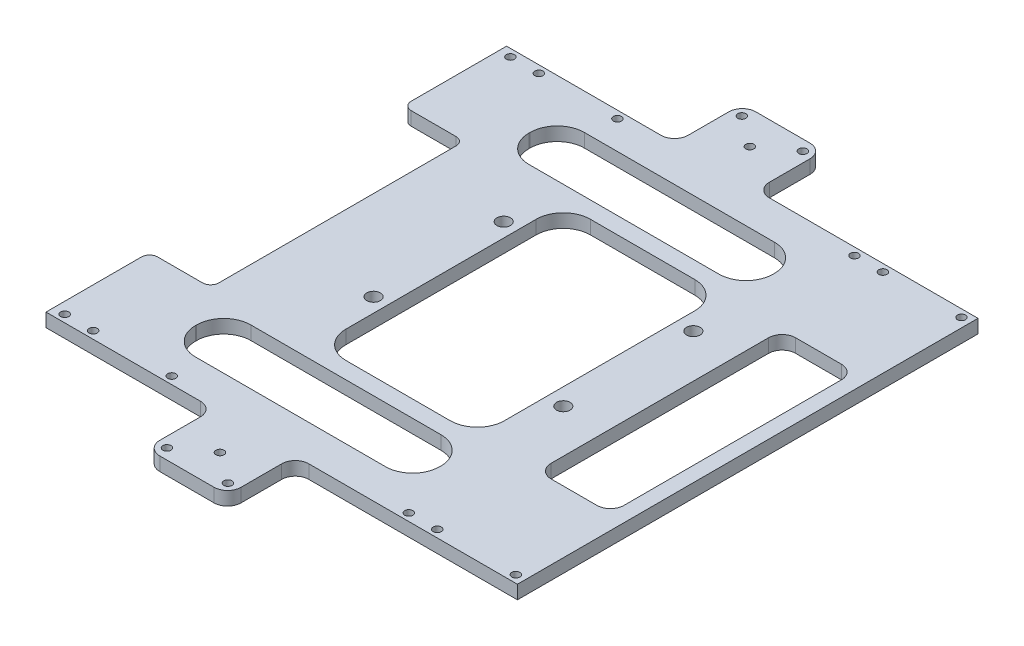
from build123d import *

# Parameters (mm, degrees)
SKETCH_1_R          = 1.5
SKETCH_1_R_2        = 2.5
EXTRUDE_1_DEPTH     = 5
CUT_EXTRUDE_1_DEPTH = 167.58331249
FILLET_1_R          = 3


with BuildPart() as part:
    # 草图1 → 凸台-拉伸1 (new body)
    with BuildSketch(Plane(origin=(0, 0, 0), x_dir=(1, 0, 0), z_dir=(0, 1, 0))):
        with BuildLine():
            Line((-125, 85), (-67.999242617, 85))
            ThreePointArc((-67.999242617, 85), (-64.463708711, 86.464466094), (-62.999242617, 90))
            Line((-62.999242617, 90), (-62.999242617, 105))
            ThreePointArc((-62.999242617, 105), (-61.534776523, 108.535533906), (-57.999242617, 110))
            Line((-57.999242617, 110), (-37.999242617, 110))
            ThreePointArc((-37.999242617, 110), (-34.463708711, 108.535533906), (-32.999242617, 105))
            Line((-32.999242617, 105), (-32.999242617, 90))
            ThreePointArc((-32.999242617, 90), (-31.534776523, 86.464466094), (-27.999242617, 85))
            Line((-27.999242617, 85), (49.000757383, 85))
            Line((49.000757383, 85), (49.000757383, -85))
            Line((49.000757383, -85), (-27.999242617, -85))
            ThreePointArc((-27.999242617, -85), (-31.534776523, -86.464466094), (-32.999242617, -90))
            Line((-32.999242617, -90), (-32.999242617, -105))
            ThreePointArc((-32.999242617, -105), (-34.463708711, -108.535533906), (-37.999242617, -110))
            Line((-37.999242617, -110), (-57.999242617, -110))
            ThreePointArc((-57.999242617, -110), (-61.534776523, -108.535533906), (-62.999242617, -105))
            Line((-62.999242617, -105), (-62.999242617, -90))
            ThreePointArc((-62.999242617, -90), (-64.463708711, -86.464466094), (-67.999242617, -85))
            Line((-67.999242617, -85), (-125, -85))
            Line((-125, -85), (-125, -46.78057254))
            Line((-125, -46.78057254), (-102.434615997, -46.78057254))
            Line((-102.434615997, -46.78057254), (-102.434615997, 46.78057254))
            Line((-102.434615997, 46.78057254), (-125, 46.78057254))
            Line((-125, 46.78057254), (-125, 85))
        make_face()
        with Locations(Location((-120.84, -82.25, 0), (0, 0, 270))):
            Circle(SKETCH_1_R, mode=Mode.SUBTRACT)
        with Locations(Location((-110.34, -82.25, 0), (0, 0, 270))):
            Circle(SKETCH_1_R, mode=Mode.SUBTRACT)
        with Locations(Location((-81.34, -82.25, 0), (0, 0, 270))):
            Circle(SKETCH_1_R, mode=Mode.SUBTRACT)
        with Locations(Location((-81.34, 82.25, 0), (0, 0, 90))):
            Circle(SKETCH_1_R, mode=Mode.SUBTRACT)
        with Locations(Location((-110.34, 82.25, 0), (0, 0, 90))):
            Circle(SKETCH_1_R, mode=Mode.SUBTRACT)
        with Locations(Location((-120.84, 82.25, 0), (0, 0, 90))):
            Circle(SKETCH_1_R, mode=Mode.SUBTRACT)
        with Locations(Location((6.16, 82.25, 0), (0, 0, 90))):
            Circle(SKETCH_1_R, mode=Mode.SUBTRACT)
        with Locations(Location((16.66, 82.25, 0), (0, 0, 90))):
            Circle(SKETCH_1_R, mode=Mode.SUBTRACT)
        with Locations(Location((45.66, 82.25, 0), (0, 0, 90))):
            Circle(SKETCH_1_R, mode=Mode.SUBTRACT)
        with Locations(Location((6.16, -82.25, 0), (0, 0, 270))):
            Circle(SKETCH_1_R, mode=Mode.SUBTRACT)
        with Locations(Location((16.66, -82.25, 0), (0, 0, 270))):
            Circle(SKETCH_1_R, mode=Mode.SUBTRACT)
        with Locations(Location((45.66, -82.25, 0), (0, 0, 270))):
            Circle(SKETCH_1_R, mode=Mode.SUBTRACT)
        with Locations(Location((-69.422345539, 28.355497102, 0), (0, 0, 270))):
            Circle(SKETCH_1_R_2, mode=Mode.SUBTRACT)
        with Locations(Location((0.577654461, 28.355497102, 0), (0, 0, 270))):
            Circle(SKETCH_1_R_2, mode=Mode.SUBTRACT)
        with Locations(Location((-69.422345539, -19.644502898, 0), (0, 0, 270))):
            Circle(SKETCH_1_R_2, mode=Mode.SUBTRACT)
        with Locations(Location((0.577654461, -19.644502898, 0), (0, 0, 270))):
            Circle(SKETCH_1_R_2, mode=Mode.SUBTRACT)
        with Locations(Location((-59.249242617, -106.1, 0), (0, 0, 270))):
            Circle(SKETCH_1_R, mode=Mode.SUBTRACT)
        with Locations(Location((-36.749242617, -106.1, 0), (0, 0, 90))):
            Circle(SKETCH_1_R, mode=Mode.SUBTRACT)
        with Locations(Location((-47.999242617, -97.789393477, 0), (0, 0, 270))):
            Circle(SKETCH_1_R, mode=Mode.SUBTRACT)
        with Locations(Location((-36.749242617, 106.1, 0), (0, 0, 270))):
            Circle(SKETCH_1_R, mode=Mode.SUBTRACT)
        with Locations(Location((-59.249242617, 106.1, 0), (0, 0, 90))):
            Circle(SKETCH_1_R, mode=Mode.SUBTRACT)
        with Locations(Location((-47.999242617, 97.789393477, 0), (0, 0, 90))):
            Circle(SKETCH_1_R, mode=Mode.SUBTRACT)
        with BuildLine():
            Line((-12.914937196, -51.31082178), (-83.083548039, -51.31082178))
            ThreePointArc((-83.083548039, -51.31082178), (-90.154615851, -54.239753968), (-93.083548039, -61.31082178))
            Line((-93.083548039, -61.31082178), (-93.083548039, -61.770331604))
            ThreePointArc((-93.083548039, -61.770331604), (-90.154615851, -68.841399416), (-83.083548039, -71.770331604))
            Line((-83.083548039, -71.770331604), (-12.914937196, -71.770331604))
            ThreePointArc((-12.914937196, -71.770331604), (-5.843869384, -68.841399416), (-2.914937196, -61.770331604))
            Line((-2.914937196, -61.770331604), (-2.914937196, -61.31082178))
            ThreePointArc((-2.914937196, -61.31082178), (-5.843869384, -54.239753968), (-12.914937196, -51.31082178))
        make_face(mode=Mode.SUBTRACT)
        with BuildLine():
            Line((-12.914937196, 71.770331604), (-83.083548039, 71.770331604))
            ThreePointArc((-83.083548039, 71.770331604), (-90.154615851, 68.841399416), (-93.083548039, 61.770331604))
            Line((-93.083548039, 61.770331604), (-93.083548039, 61.31082178))
            ThreePointArc((-93.083548039, 61.31082178), (-90.154615851, 54.239753968), (-83.083548039, 51.31082178))
            Line((-83.083548039, 51.31082178), (-12.914937196, 51.31082178))
            ThreePointArc((-12.914937196, 51.31082178), (-5.843869384, 54.239753968), (-2.914937196, 61.31082178))
            Line((-2.914937196, 61.31082178), (-2.914937196, 61.770331604))
            ThreePointArc((-2.914937196, 61.770331604), (-5.843869384, 68.841399416), (-12.914937196, 71.770331604))
        make_face(mode=Mode.SUBTRACT)
        with BuildLine():
            Line((-15.665960641, 45.130463402), (-54.200019018, 45.130463402))
            ThreePointArc((-54.200019018, 45.130463402), (-61.27108683, 42.201531214), (-64.200019018, 35.130463402))
            Line((-64.200019018, 35.130463402), (-64.200019018, -35.130463402))
            ThreePointArc((-64.200019018, -35.130463402), (-61.27108683, -42.201531214), (-54.200019018, -45.130463402))
            Line((-54.200019018, -45.130463402), (-15.665960641, -45.130463402))
            ThreePointArc((-15.665960641, -45.130463402), (-8.594892829, -42.201531214), (-5.665960641, -35.130463402))
            Line((-5.665960641, -35.130463402), (-5.665960641, 35.130463402))
            ThreePointArc((-5.665960641, 35.130463402), (-8.594892829, 42.201531214), (-15.665960641, 45.130463402))
        make_face(mode=Mode.SUBTRACT)
    extrude(amount=EXTRUDE_1_DEPTH)

    # 草图2 → 切除-拉伸1 (cut, through all)
    with BuildSketch(Plane.XZ):
        with BuildLine():
            Line((21.556311208, 45.130463402), (38.464260393, 45.130463402))
            ThreePointArc((38.464260393, 45.130463402), (41.999794299, 43.665997308), (43.464260393, 40.130463402))
            Line((43.464260393, 40.130463402), (43.464260393, -40.130463402))
            ThreePointArc((43.464260393, -40.130463402), (41.999794299, -43.665997308), (38.464260393, -45.130463402))
            Line((38.464260393, -45.130463402), (21.556311208, -45.130463402))
            ThreePointArc((21.556311208, -45.130463402), (18.020777302, -43.665997308), (16.556311208, -40.130463402))
            Line((16.556311208, -40.130463402), (16.556311208, 40.130463402))
            ThreePointArc((16.556311208, 40.130463402), (18.020777302, 43.665997308), (21.556311208, 45.130463402))
        make_face()
    extrude(amount=-CUT_EXTRUDE_1_DEPTH, mode=Mode.SUBTRACT)

    # 圆角1
    fillet_1_edges = [part.edges().sort_by_distance(p)[0] for p in [
        (-125, 2.5, 46.78057254),
        (-102.434615997, 2.5, 46.78057254),
        (-102.434615997, 2.5, -46.78057254),
        (-125, 2.5, -46.78057254),
    ]]
    fillet(fillet_1_edges, radius=FILLET_1_R)


solid = part.part
